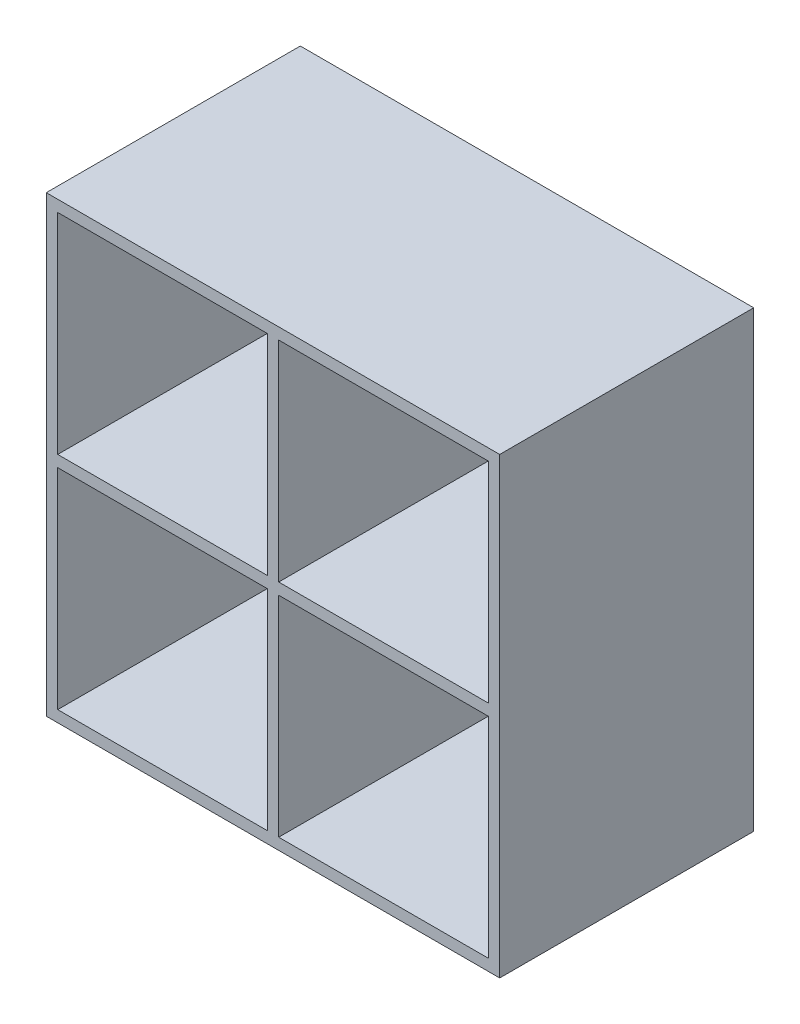
from build123d import *

# Parameters (mm, degrees)
SKETCH1_W           = 714
SKETCH1_H           = 714
SKETCH1_W_2         = 330
SKETCH1_H_2         = 330
BOSS_EXTRUDE1_DEPTH = 400


with BuildPart() as part:
    # Sketch1 → Boss-Extrude1 (new body)
    with BuildSketch(Plane.XY):
        Rectangle(SKETCH1_W, SKETCH1_H)
        with Locations((-174, 174)):
            Rectangle(SKETCH1_W_2, SKETCH1_H_2, mode=Mode.SUBTRACT)
        with Locations((174, 174)):
            Rectangle(SKETCH1_W_2, SKETCH1_H_2, mode=Mode.SUBTRACT)
        with Locations((174, -174)):
            Rectangle(SKETCH1_W_2, SKETCH1_H_2, mode=Mode.SUBTRACT)
        with Locations((-174, -174)):
            Rectangle(SKETCH1_W_2, SKETCH1_H_2, mode=Mode.SUBTRACT)
    extrude(amount=-BOSS_EXTRUDE1_DEPTH)


solid = part.part
